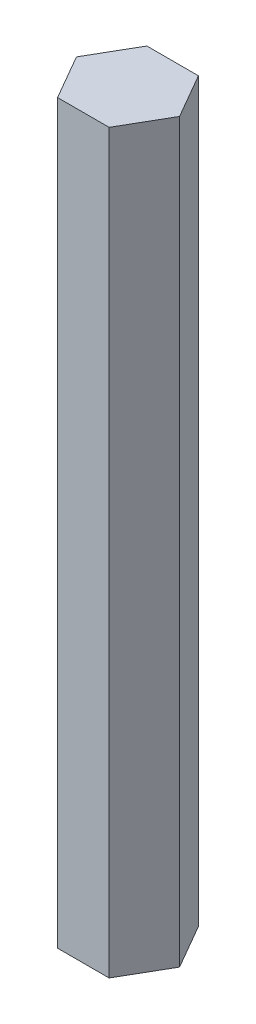
from build123d import *

# Parameters (mm, degrees)
BOSS_EXTRUDE1_DEPTH = 104.775


with BuildPart() as part:
    # Sketch1 → Boss-Extrude1 (new body)
    with BuildSketch(Plane(origin=(0, 0, 0), x_dir=(1, 0, 0), z_dir=(0, 1, 0))):
        Polygon((7.332348419, 0), (3.666174209, 6.35), (-3.666174209, 6.35), (-7.332348419, 0), (-3.666174209, -6.35), (3.666174209, -6.35), align=None)
    extrude(amount=BOSS_EXTRUDE1_DEPTH)


solid = part.part
